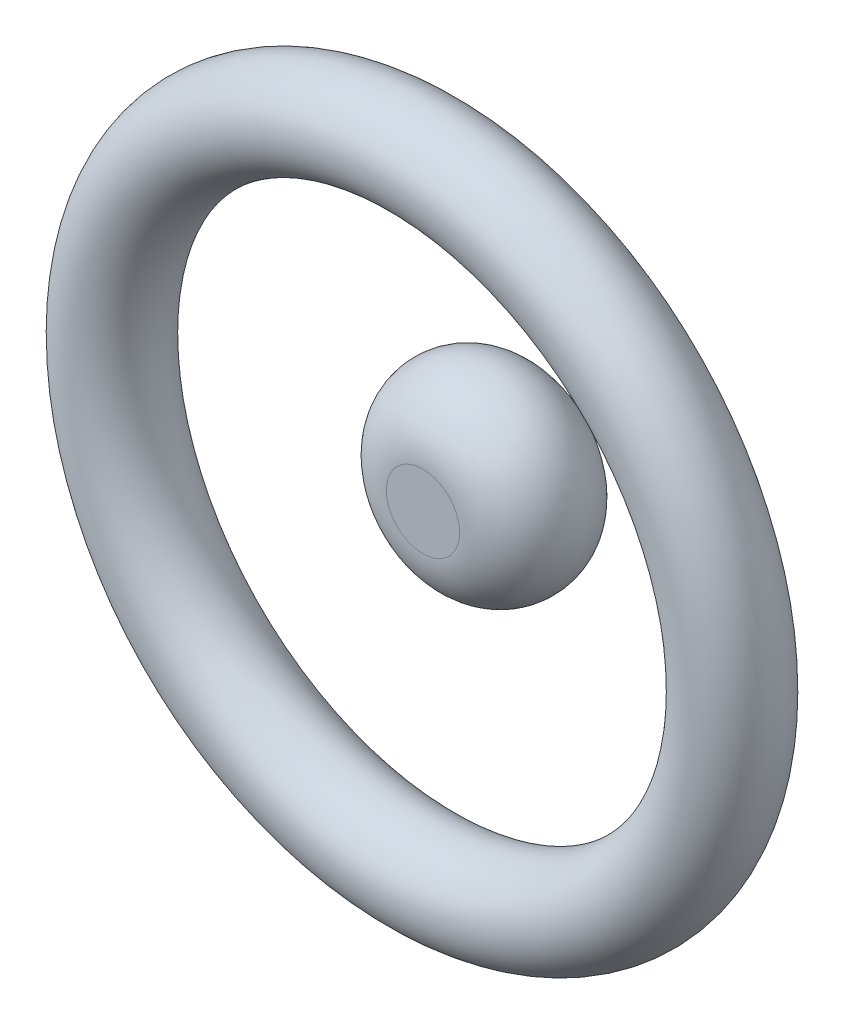
from build123d import *

# Parameters (mm, degrees)
SKETCH1_R = 19.05


with BuildPart() as part:
    # Sketch1 → Revolve1 (revolve)
    with BuildSketch(Plane(origin=(0, 0, 0), x_dir=(0, 0, -1), z_dir=(1, 0, 0))):
        with Locations((-25.4, 127)):
            Circle(SKETCH1_R)
        with BuildLine():
            Line((-25, 0), (25, 0))
            Line((25, 0), (25, 15))
            ThreePointArc((25, 15), (0, 40), (-25, 15))
            Line((-25, 15), (-25, 0))
        make_face()
    revolve(axis=Axis((0, 0, 113.596885813), (0, 0, -1)))


solid = part.part
